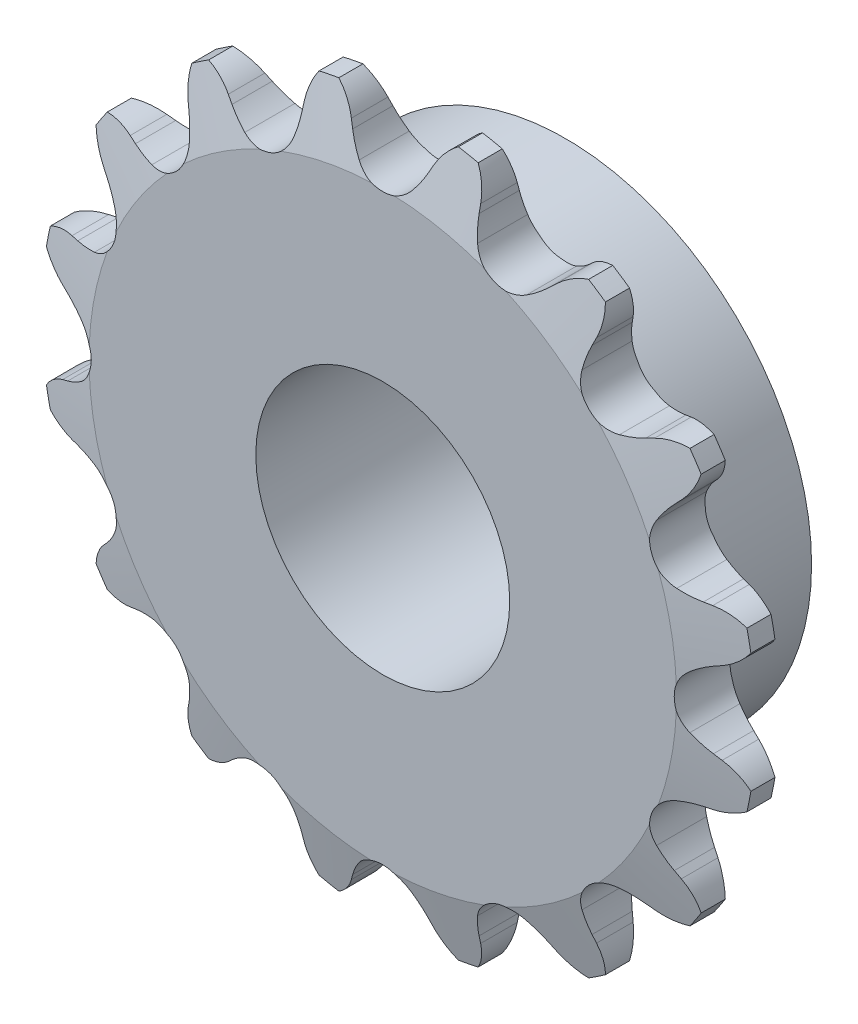
from build123d import *

# Parameters (mm, degrees)
TOOTH_CUT_NUMBER_OF_TEETH_16_DEPTH = 26.306064487
TOOTH_PATTERN_16_16_COUNT          = 16
SKETCH3_W                          = 9.906
SKETCH3_H                          = 12.303125
SKETCH4_R                          = 6.35
CUT_EXTRUDE1_DEPTH                 = 28.961810266
SKETCH13_R                         = 12.303125
SKETCH13_R_2                       = 6.35
CUT_EXTRUDE5_DEPTH                 = 3.556


with BuildPart() as part:
    # Sprocket-BaseSketch → 25 (04C) ANSI (ISO) Chain Number, 1.281in P.D. (revolve)
    with BuildSketch(Plane(origin=(0, 0, 0), x_dir=(0, 0, -1), z_dir=(1, 0, 0))):
        Polygon((1.397, 0), (1.397, 14.691802887), (0.60325, 17.866802887), (-0.60325, 17.866802887), (-1.397, 14.691802887), (-1.397, 0), align=None)
    revolve(axis=Axis((0, 0, -5.588), (0, 0, 1)))

    # Tooth-Sketch → Tooth-Cut, Number of teeth: 16 (cut, symmetric)
    with BuildSketch(Plane.XY):
        with BuildLine():
            Line((1.895951627, 16.145861918), (2.051408678, 16.490963774))
            ThreePointArc((2.051408678, 16.490963774), (3.056004647, 17.659429879), (4.533974194, 18.095471295))
            ThreePointArc((4.533974194, 18.095471295), (0, 18.654838605), (-4.533974194, 18.095471295))
            ThreePointArc((-4.533974194, 18.095471295), (-3.056004647, 17.659429879), (-2.051408678, 16.490963774))
            Line((-2.051408678, 16.490963774), (-1.895951627, 16.145861918))
            ThreePointArc((-1.895951627, 16.145861918), (-1.639424454, 15.660854777), (-1.323740827, 15.212098758))
            ThreePointArc((-1.323740827, 15.212098758), (0, 14.577158093), (1.323740827, 15.212098758))
            ThreePointArc((1.323740827, 15.212098758), (1.639424454, 15.660854777), (1.895951627, 16.145861918))
        make_face()
    tooth_cut_number_of_teeth_16 = extrude(amount=TOOTH_CUT_NUMBER_OF_TEETH_16_DEPTH, both=True, mode=Mode.SUBTRACT)

    # Tooth Pattern, 16 / 16: Tooth-Cut, Number of teeth: 16 ×16 about axis
    tooth_pattern_16_16_axis = Axis((0, 0, -88.99), (0, 0, 1))
    for i in range(1, TOOTH_PATTERN_16_16_COUNT):
        add(tooth_cut_number_of_teeth_16.rotate(tooth_pattern_16_16_axis, i * 360 / TOOTH_PATTERN_16_16_COUNT), mode=Mode.SUBTRACT)

    # Sketch3 → Hub-Revolve1 (revolve)
    with BuildSketch(Plane(origin=(0, 0, 0), x_dir=(0, 0, -1), z_dir=(1, 0, 0))):
        with Locations((6.35, 6.1515625)):
            Rectangle(SKETCH3_W, SKETCH3_H)
    revolve(axis=Axis((0, 0, 9.906), (0, 0, -1)))

    # Sketch4 → Cut-Extrude1 (cut, through all)
    with BuildSketch(Plane(origin=(0, 0, -11.303), x_dir=(-1, 0, 0), z_dir=(0, 0, -1))):
        Circle(SKETCH4_R)
    extrude(amount=-CUT_EXTRUDE1_DEPTH, mode=Mode.SUBTRACT)

    # Sketch13 → Cut-Extrude5 (cut)
    with BuildSketch(Plane(origin=(0, 0, -11.303), x_dir=(-1, 0, 0), z_dir=(0, 0, -1))):
        Circle(SKETCH13_R)
        Circle(SKETCH13_R_2, mode=Mode.SUBTRACT)
    extrude(amount=-CUT_EXTRUDE5_DEPTH, mode=Mode.SUBTRACT)


solid = part.part
